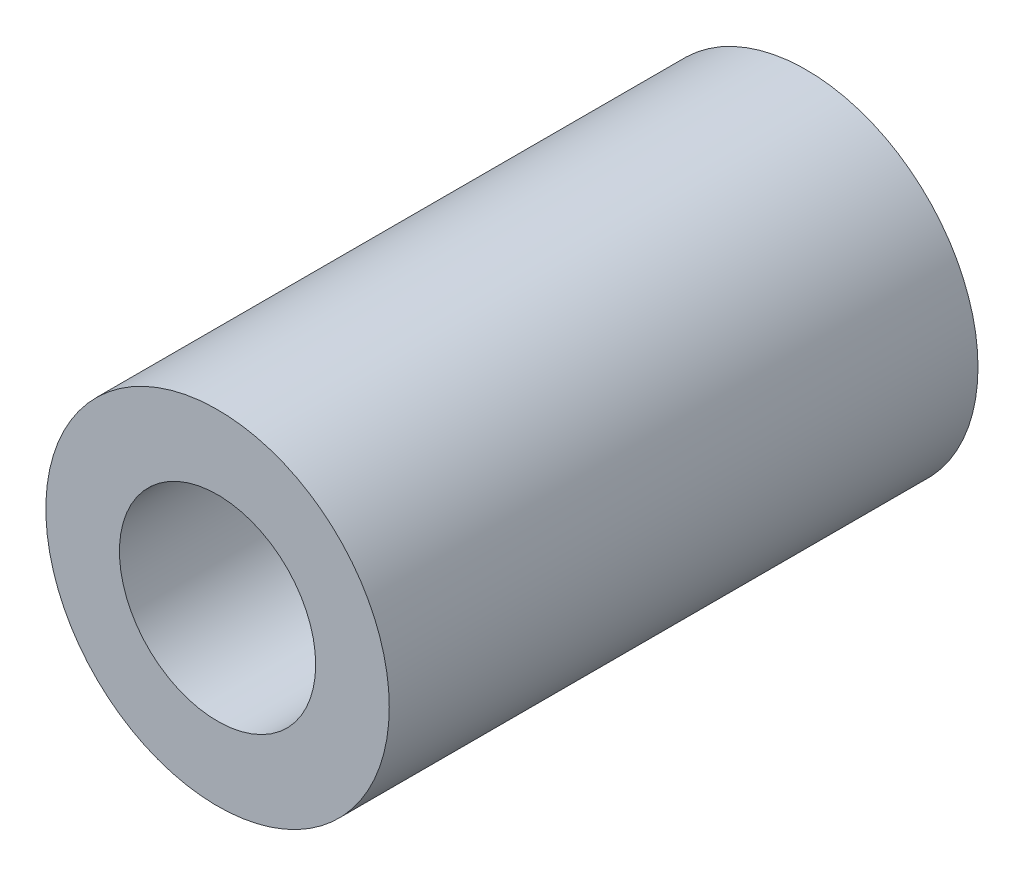
from build123d import *

# Parameters (mm, degrees)
ESQUISSE1_R          = 7
ESQUISSE1_R_2        = 4
BASE_EXTRUSION_DEPTH = 24


with BuildPart() as part:
    # Esquisse1 → Base-Extrusion (new body)
    with BuildSketch(Plane.XY):
        Circle(ESQUISSE1_R)
        Circle(ESQUISSE1_R_2, mode=Mode.SUBTRACT)
    extrude(amount=BASE_EXTRUSION_DEPTH)


solid = part.part
